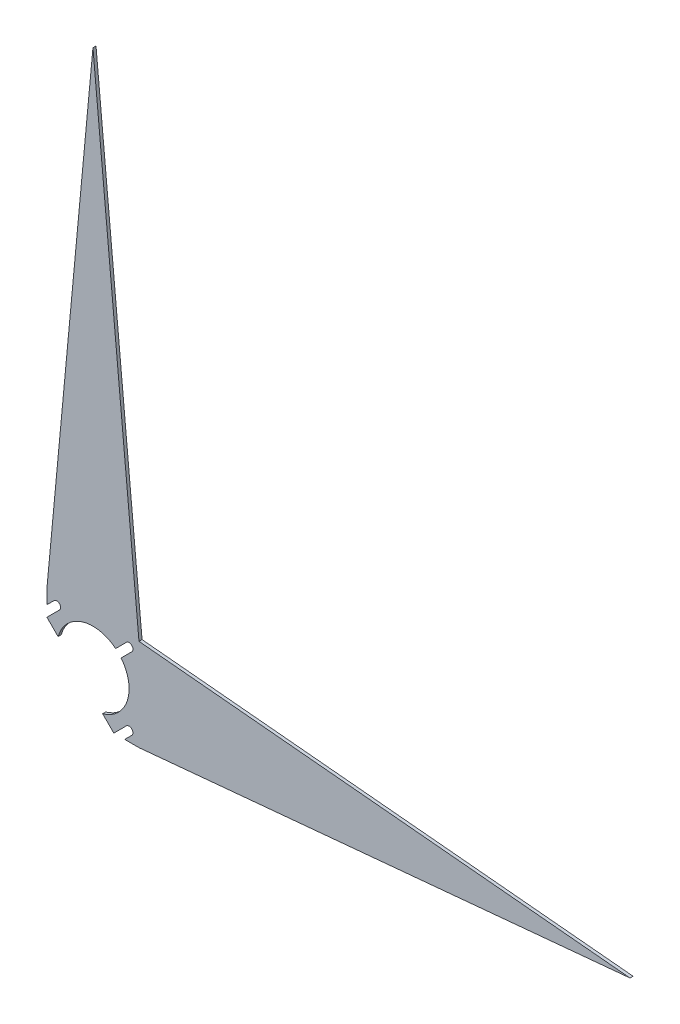
from build123d import *

# Parameters (mm, degrees)
SKETCH_1_R          = 2.5
SKETCH_1_R_2        = 23.57
EXTRUDE_1_DEPTH     = 2
CUT_EXTRUDE_1_DEPTH = 2


with BuildPart() as part:
    # 草图1 → 凸台-拉伸1 (new body)
    with BuildSketch(Plane.XY):
        Polygon((53.57, -53.57), (373.57, -23.57), (53.57, 6.43), (23.57, 326.43), (-6.43, 6.43), (-6.43, -53.57), align=None)
        Circle(SKETCH_1_R, mode=Mode.SUBTRACT)
        with Locations((47.14, 0)):
            Circle(SKETCH_1_R, mode=Mode.SUBTRACT)
        with Locations((0, -47.14)):
            Circle(SKETCH_1_R, mode=Mode.SUBTRACT)
        with Locations((47.14, -47.14)):
            Circle(SKETCH_1_R, mode=Mode.SUBTRACT)
        with Locations((23.57, -23.57)):
            Circle(SKETCH_1_R_2, mode=Mode.SUBTRACT)
    extrude(amount=EXTRUDE_1_DEPTH)

    # 草图2 → 切除-拉伸1 (cut)
    with BuildSketch(Plane.XY.offset(2)):
        Polygon((-1.767766953, 1.767766953), (-23.224943384, -19.689409478), (-48.141739781, -16.773526249), (-61.418914174, -41.57875584), (11.806639012, -99.639884024), (27.505819552, -70.309714354), (48.907766953, -48.907766953), (45.372233047, -45.372233047), (37.174466094, -53.57), (-6.43, -9.965533906), (1.767766953, -1.767766953), align=None)
        Polygon((45.372233047, 1.767766953), (27.505819552, -16.098646542), (32.100864157, -18.574669749), (48.907766953, -1.767766953), align=None)
    extrude(amount=-CUT_EXTRUDE_1_DEPTH, mode=Mode.SUBTRACT)


solid = part.part
